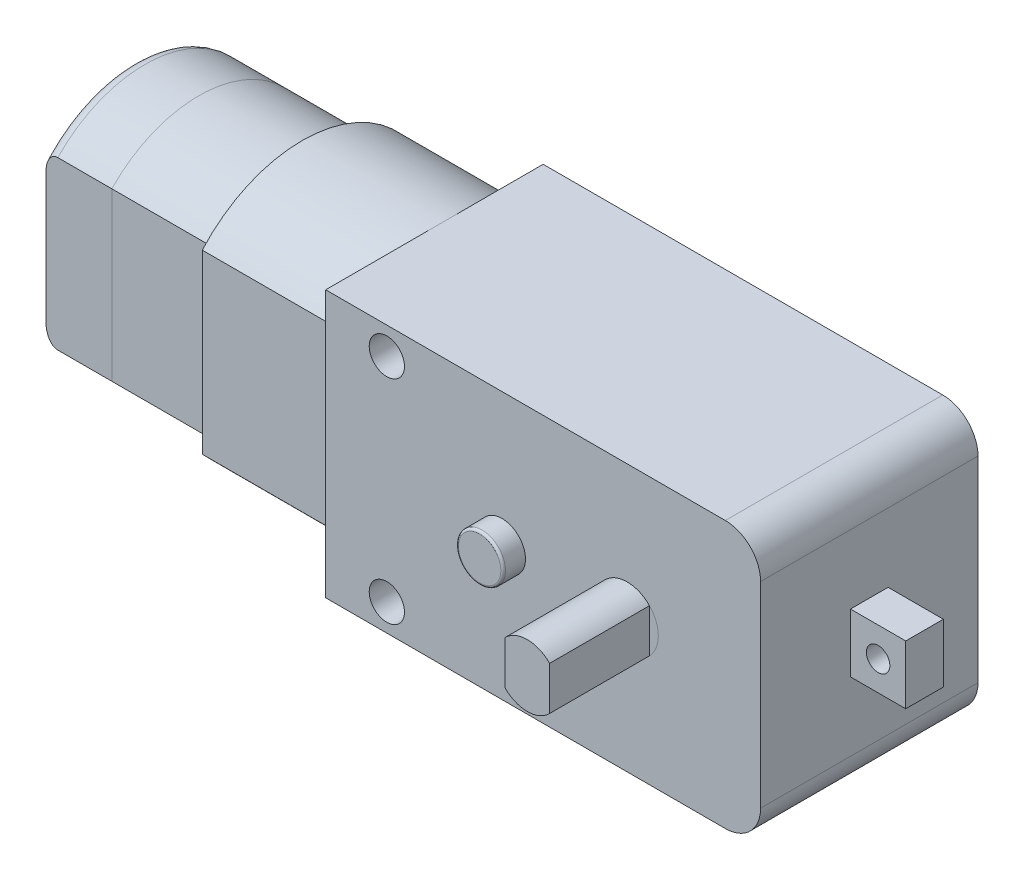
from build123d import *

# Parameters (mm, degrees)
SALIENTE_EXTRUIR1_DEPTH       = 9.25
SALIENTE_EXTRUIR1_DEPTH_BACK  = 9.25
SALIENTE_EXTRUIR2_DEPTH       = 12
CROQUIS3_W                    = 3.2
CROQUIS3_H                    = 5
SALIENTE_EXTRUIR3_DEPTH       = 4.7
CORTAR_EXTRUIR1_DEPTH         = 28
CORTAR_EXTRUIR1_DEPTH_BACK    = 17.7
CROQUIS4_R                    = 1.5
CROQUIS5_R                    = 2
SALIENTE_EXTRUIR4_DEPTH       = 1.9
REDONDEO1_R                   = 0.2
CROQUIS6_R                    = 2.65
CORTAR_EXTRUIR2_DEPTH         = 23.9
SALIENTE_EXTRUIR5_DEPTH       = 8.8
SALIENTE_EXTRUIR6_DEPTH       = 5.6
REDONDEO2_R                   = 1
SALIENTE_EXTRUIR7_DEPTH       = 2
CROQUIS12_R                   = 1
SALIENTE_EXTRUIR8_DEPTH       = 1
CROQUIS13_W                   = 3
CROQUIS13_H                   = 8
SALIENTE_EXTRUIR9_DEPTH       = 1.2
CROQUIS14_R                   = 1
CORTAR_EXTRUIR3_DEPTH         = 4.2
SALIENTE_EXTRUIR10_DEPTH      = 17.75
SALIENTE_EXTRUIR10_DEPTH_BACK = 20.25
SALIENTE_EXTRUIR11_DEPTH      = 9.25
SALIENTE_EXTRUIR11_DEPTH_BACK = 12.25
CROQUIS16_R                   = 2.65
SKETCH_1_W                    = 9.867369552
SKETCH_1_H                    = 12.675768788
CUT_EXTRUDE_1_DEPTH           = 32


with BuildPart() as part:
    # Croquis1 → Saliente-Extruir1 (new, two sides: drawn at the far end of the back side and taken through both)
    with BuildSketch(Plane.XY.offset(-SALIENTE_EXTRUIR1_DEPTH_BACK)):
        with BuildLine():
            Line((-18.5, -11.35), (15.5, -11.35))
            ThreePointArc((15.5, -11.35), (17.621320344, -10.471320344), (18.5, -8.35))
            Line((18.5, -8.35), (18.5, 8.35))
            ThreePointArc((18.5, 8.35), (17.621320344, 10.471320344), (15.5, 11.35))
            Line((15.5, 11.35), (-18.5, 11.35))
            Line((-18.5, 11.35), (-18.5, -11.35))
        make_face()
    extrude(amount=SALIENTE_EXTRUIR1_DEPTH + SALIENTE_EXTRUIR1_DEPTH_BACK)

    # Croquis2 → Saliente-Extruir2 (add)
    with BuildSketch(Plane.ZY.offset(18.5)):
        with BuildLine():
            Line((7.75, -7.521469271), (7.75, 7.521469271))
            ThreePointArc((7.75, 7.521469271), (-0.75, 11.35), (-9.25, 7.521469271))
            Line((-9.25, 7.521469271), (-9.25, -7.521469271))
            ThreePointArc((-9.25, -7.521469271), (-0.75, -11.35), (7.75, -7.521469271))
        make_face()
    extrude(amount=SALIENTE_EXTRUIR2_DEPTH)

    # Croquis3 → Saliente-Extruir3 (add)
    with BuildSketch(Plane(origin=(18.5, 0, 0), x_dir=(0, 0, -1), z_dir=(1, 0, 0))):
        Rectangle(CROQUIS3_W, CROQUIS3_H)
    extrude(amount=SALIENTE_EXTRUIR3_DEPTH)

    # Croquis4 → Cortar-Extruir1 (cut, two sides: drawn at the far end of the back side and taken through both)
    with BuildSketch(Plane.XY.offset(-CORTAR_EXTRUIR1_DEPTH_BACK)):
        with Locations(Location((-13.3, 9.05, 0), (0, 0, 180))):
            Circle(CROQUIS4_R)
        with Locations(Location((-13.3, -9.05, 0), (0, 0, 180))):
            Circle(CROQUIS4_R)
    extrude(amount=CORTAR_EXTRUIR1_DEPTH + CORTAR_EXTRUIR1_DEPTH_BACK, mode=Mode.SUBTRACT)

    # Croquis5 → Saliente-Extruir4 (add)
    with BuildSketch(Plane.XY.offset(9.25)):
        with Locations(Location((-3.5, 0, 0), (0, 0, 180))):
            Circle(CROQUIS5_R)
    extrude(amount=SALIENTE_EXTRUIR4_DEPTH)

    # Redondeo1
    redondeo1_edges = [part.edges().sort_by_distance(p)[0] for p in [
        (-1.5, 0, 11.15),
    ]]
    fillet(redondeo1_edges, radius=REDONDEO1_R)

    # Croquis6 → Cortar-Extruir2 (cut)
    with BuildSketch(Plane.XY.offset(9.25)):
        with Locations((7.15, 0)):
            Circle(CROQUIS6_R)
    extrude(amount=-CORTAR_EXTRUIR2_DEPTH, mode=Mode.SUBTRACT)

    # Croquis14 → Cortar-Extruir3 (cut)
    with BuildSketch(Plane.XY.offset(1.6)):
        with Locations((20.85, 0)):
            Circle(CROQUIS14_R)
    extrude(amount=-CORTAR_EXTRUIR3_DEPTH, mode=Mode.SUBTRACT)


with BuildPart() as body_2:
    # Croquis9 → Saliente-Extruir5 (new body)
    with BuildSketch(Plane.ZY.offset(30.5)):
        with BuildLine():
            Line((6.65, -7.092425537), (6.65, 7.092425537))
            ThreePointArc((6.65, 7.092425537), (-0.75, 10.25), (-8.15, 7.092425537))
            Line((-8.15, 7.092425537), (-8.15, -7.092425537))
            ThreePointArc((-8.15, -7.092425537), (-0.75, -10.25), (6.65, -7.092425537))
        make_face()
    extrude(amount=SALIENTE_EXTRUIR5_DEPTH)


with BuildPart() as body_3:
    # Croquis10 → Saliente-Extruir6 (new body)
    with BuildSketch(Plane.ZY.offset(39.3)):
        with BuildLine():
            Line((-8.15, 7.092425537), (-8.15, -7.092425537))
            ThreePointArc((-8.15, -7.092425537), (-0.75, -10.25), (6.65, -7.092425537))
            Line((6.65, -7.092425537), (6.65, 7.092425537))
            ThreePointArc((6.65, 7.092425537), (-0.75, 10.25), (-8.15, 7.092425537))
        make_face()
    extrude(amount=SALIENTE_EXTRUIR6_DEPTH)

    # Redondeo2
    redondeo2_edges = [body_3.edges().sort_by_distance(p)[0] for p in [
        (-44.9, -10.25, -0.75),
        (-44.9, 10.25, -0.75),
    ]]
    fillet(redondeo2_edges, radius=REDONDEO2_R)


with BuildPart() as body_4:
    # Croquis11 → Saliente-Extruir7 (new body)
    with BuildSketch(Plane.ZY.offset(44.9)):
        with BuildLine():
            Line((2.65, 3.666060556), (2.65, -3.666060556))
            ThreePointArc((2.65, -3.666060556), (-5.75, 0), (2.65, 3.666060556))
        make_face()
    extrude(amount=SALIENTE_EXTRUIR7_DEPTH)


with BuildPart() as body_5:
    # Croquis12 → Saliente-Extruir8 (new body)
    with BuildSketch(Plane.ZY.offset(46.9)):
        with Locations((-0.75, 0)):
            Circle(CROQUIS12_R)
    extrude(amount=SALIENTE_EXTRUIR8_DEPTH)


with BuildPart() as body_6:
    # Croquis13 → Saliente-Extruir9 (new body)
    with BuildSketch(Plane(origin=(0, 0, -8.15), x_dir=(-1, 0, 0), z_dir=(0, 0, -1))):
        with Locations((40.8, 0)):
            Rectangle(CROQUIS13_W, CROQUIS13_H)
    extrude(amount=SALIENTE_EXTRUIR9_DEPTH)


with BuildPart() as body_7:
    # Croquis15 → Saliente-Extruir10 (new, two sides: drawn at the far end of the back side and taken through both)
    with BuildSketch(Plane.XY.offset(-SALIENTE_EXTRUIR10_DEPTH_BACK)):
        with BuildLine():
            Line((9.05, -1.84729532), (9.05, 1.84729532))
            ThreePointArc((9.05, 1.84729532), (7.15, 2.65), (5.25, 1.84729532))
            Line((5.25, 1.84729532), (5.25, -1.84729532))
            ThreePointArc((5.25, -1.84729532), (7.15, -2.65), (9.05, -1.84729532))
        make_face()
    extrude(amount=SALIENTE_EXTRUIR10_DEPTH + SALIENTE_EXTRUIR10_DEPTH_BACK)


with BuildPart() as body_8:
    # Croquis16 → Saliente-Extruir11 (new, two sides: drawn at the far end of the back side and taken through both)
    with BuildSketch(Plane.XY.offset(-SALIENTE_EXTRUIR11_DEPTH_BACK)):
        with Locations((7.15, 0)):
            Circle(CROQUIS16_R)
    extrude(amount=SALIENTE_EXTRUIR11_DEPTH + SALIENTE_EXTRUIR11_DEPTH_BACK)


with BuildPart() as cut_extrude_1_tool:
    # 草图1 → 切除-拉伸1 (new body)
    with BuildSketch(Plane(origin=(0, 11.35, 0), x_dir=(1, 0, 0), z_dir=(0, 1, 0))):
        with Locations((7.089458597, 15.587884394)):
            Rectangle(SKETCH_1_W, SKETCH_1_H)
    extrude(amount=-CUT_EXTRUDE_1_DEPTH)


with BuildPart() as body_7_1:
    add(body_7.part)

    # 切除-拉伸1: cut by cut_extrude_1_tool
    add(cut_extrude_1_tool.part, mode=Mode.SUBTRACT)


with BuildPart() as body_8_1:
    add(body_8.part)

    # 切除-拉伸1: cut by cut_extrude_1_tool
    add(cut_extrude_1_tool.part, mode=Mode.SUBTRACT)


solid = Compound([part.part, body_2.part, body_3.part, body_4.part, body_5.part, body_6.part, body_7_1.part, body_8_1.part])
